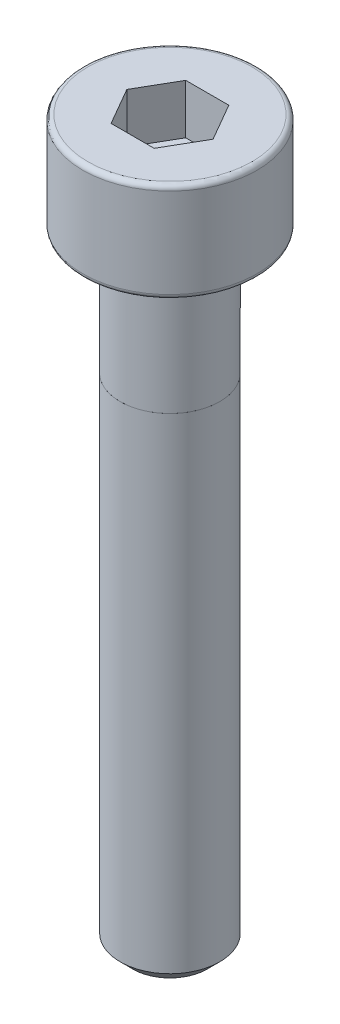
from build123d import *

# Parameters (mm, degrees)
SKETCH1_R           = 3.5
BOSS_EXTRUDE1_DEPTH = 4
CUT_EXTRUDE1_DEPTH  = 2
SKETCH3_R           = 2
BOSS_EXTRUDE2_DEPTH = 5
SKETCH4_R           = 2
BOSS_EXTRUDE3_DEPTH = 20
CHAMFER1_SIZE       = 0.5
FILLET1_R           = 0.2


with BuildPart() as part:
    # Sketch1 → Boss-Extrude1 (new body)
    with BuildSketch(Plane(origin=(0, 0, 0), x_dir=(1, 0, 0), z_dir=(0, 1, 0))):
        with Locations(Location((0, 0, 0), (0, 0, 270))):
            Circle(SKETCH1_R)
    extrude(amount=-BOSS_EXTRUDE1_DEPTH)

    # Sketch2 → Cut-Extrude1 (cut)
    with BuildSketch(Plane(origin=(0, 0, 0), x_dir=(1, 0, 0), z_dir=(0, 1, 0))):
        Polygon((1.732050808, 0), (0.866025404, 1.5), (-0.866025404, 1.5), (-1.732050808, 0), (-0.866025404, -1.5), (0.866025404, -1.5), align=None)
    extrude(amount=-CUT_EXTRUDE1_DEPTH, mode=Mode.SUBTRACT)

    # Sketch3 → Boss-Extrude2 (add)
    with BuildSketch(Plane.XZ.offset(4)):
        with Locations(Location((0, 0, 0), (0, 0, 90))):
            Circle(SKETCH3_R)
    extrude(amount=BOSS_EXTRUDE2_DEPTH)

    # Fillet1
    fillet1_edges = [part.edges().sort_by_distance(p)[0] for p in [
        (0, 0, -3.5),
        (0, -4, -3.5),
    ]]
    fillet(fillet1_edges, radius=FILLET1_R)


with BuildPart() as body_2:
    # Sketch4 → Boss-Extrude3 (new body)
    with BuildSketch(Plane.XZ.offset(9)):
        with Locations(Location((0, 0, 0), (0, 0, 270))):
            Circle(SKETCH4_R)
    extrude(amount=BOSS_EXTRUDE3_DEPTH)

    # Chamfer1
    chamfer1_edges = [body_2.edges().sort_by_distance(p)[0] for p in [
        (0, -29, 2),
    ]]
    chamfer(chamfer1_edges, length=CHAMFER1_SIZE)


solid = Compound([part.part, body_2.part])
